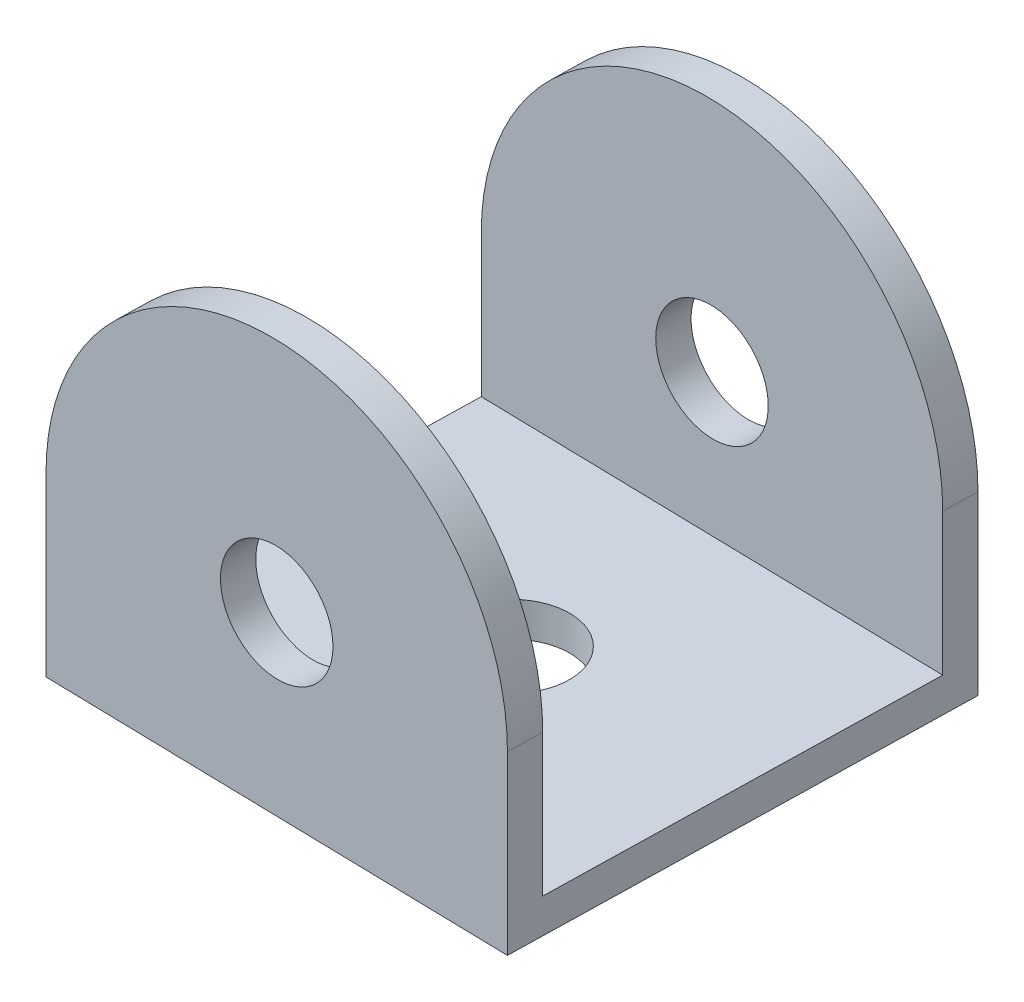
from build123d import *

# Parameters (mm, degrees)
BOSS_EXTRUDE1_DEPTH = 3
SKETCH2_R           = 5
CUT_EXTRUDE1_DEPTH  = 3
SKETCH4_R           = 5
BOSS_EXTRUDE2_DEPTH = 3
BOSS_EXTRUDE3_START = -3
SKETCH5_R           = 5
BOSS_EXTRUDE3_DEPTH = 3


with BuildPart() as part:
    # Sketch1 → Boss-Extrude1 (new body)
    with BuildSketch(Plane(origin=(0, 0, 0), x_dir=(1, 0, 0), z_dir=(0, 1, 0))):
        Polygon((0, 0), (40.989942652, -0.908075633), (41.875870099, 39.082112321), (0.885927446, 39.990187954), align=None)
    extrude(amount=BOSS_EXTRUDE1_DEPTH)

    # Sketch2 → Cut-Extrude1 (cut)
    with BuildSketch(Plane(origin=(0, 3, 0), x_dir=(1, 0, 0), z_dir=(0, 1, 0))):
        with Locations(Location((20.937935049, 19.54105616, 0), (0, 0, 270))):
            Circle(SKETCH2_R)
    extrude(amount=-CUT_EXTRUDE1_DEPTH, mode=Mode.SUBTRACT)

    # Sketch4 → Boss-Extrude2 (add)
    with BuildSketch(Plane(origin=(0, 0, 0), x_dir=(0.9997546988385365, 0, 0.022148186162014694), z_dir=(-0.02214818616201469, 0, 0.9997546988385364))):
        with BuildLine():
            Line((41, 15.324050928), (41, 3))
            Line((41, 3), (0, 3))
            Line((0, 3), (0, 15.324050928))
            ThreePointArc((0, 15.324050928), (20.5, 35.824050928), (41, 15.324050928))
        make_face()
        with Locations((20.5, 15.324050928)):
            Circle(SKETCH4_R, mode=Mode.SUBTRACT)
    extrude(amount=-BOSS_EXTRUDE2_DEPTH)

    # Sketch5 → Boss-Extrude3 (add)
    with BuildSketch(Plane(origin=(0.885927446, 0, -39.990187954), x_dir=(-0.9997546988385365, 0, -0.022148186162014458), z_dir=(0.022148186162014454, 0, -0.9997546988385364)).offset(BOSS_EXTRUDE3_START)):
        with BuildLine():
            Line((-41, 3), (-41, 15.324050928))
            ThreePointArc((-41, 15.324050928), (-20.5, 35.824050928), (0, 15.324050928))
            Line((0, 15.324050928), (0, 3))
            Line((0, 3), (-41, 3))
        make_face()
        with Locations(Location((-20.5, 15.324050928, 0), (0, 0, 180))):
            Circle(SKETCH5_R, mode=Mode.SUBTRACT)
    extrude(amount=BOSS_EXTRUDE3_DEPTH)


solid = part.part
